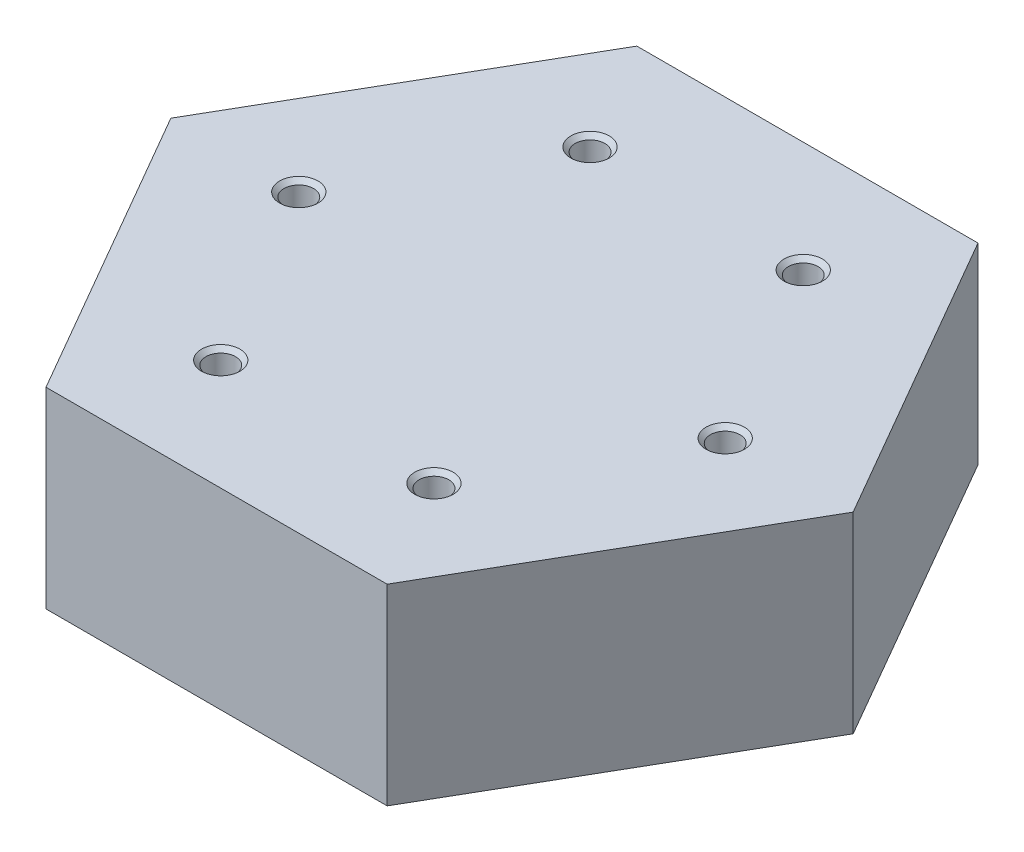
from build123d import *

# Parameters (mm, degrees)
BOSS_EXTRUDE1_DEPTH                         = 16.51
F_1_4_20_TAPPED_HOLE1_D                     = 5.1054
F_1_4_20_TAPPED_HOLE1_DEPTH                 = 19.05
F_1_4_20_TAPPED_HOLE1_CSINK_D               = 6.604
F_1_4_20_TAPPED_HOLE1_CSINK_ANGLE           = 90
F_1_4_20_TAPPED_HOLE1_TIP                   = 1.533816902
F_1_4_20_TAPPED_HOLE1_ON_FACE_2_D           = 5.1054
F_1_4_20_TAPPED_HOLE1_ON_FACE_2_DEPTH       = 19.05
F_1_4_20_TAPPED_HOLE1_ON_FACE_2_CSINK_D     = 6.604
F_1_4_20_TAPPED_HOLE1_ON_FACE_2_CSINK_ANGLE = 90
F_1_4_20_TAPPED_HOLE1_ON_FACE_2_TIP         = 1.533816902
F_1_4_20_TAPPED_HOLE1_ON_FACE_3_D           = 5.1054
F_1_4_20_TAPPED_HOLE1_ON_FACE_3_DEPTH       = 19.05
F_1_4_20_TAPPED_HOLE1_ON_FACE_3_CSINK_D     = 6.604
F_1_4_20_TAPPED_HOLE1_ON_FACE_3_CSINK_ANGLE = 90
F_1_4_20_TAPPED_HOLE1_ON_FACE_3_TIP         = 1.533816902


with BuildPart() as part:
    # Sketch1 → Boss-Extrude1 (new, symmetric)
    with BuildSketch(Plane(origin=(0, 0, 0), x_dir=(1, 0, 0), z_dir=(0, 1, 0))):
        Polygon((-58.65878735, 0), (-29.329393675, -50.8), (29.329393675, -50.8), (58.65878735, 0), (29.329393675, 50.8), (-29.329393675, 50.8), align=None)
    extrude(amount=BOSS_EXTRUDE1_DEPTH, both=True)

    # 1/4-20 Tapped Hole1
    with Locations(Plane(origin=(-43.994090512, 0, -25.4), x_dir=(0.5, 0, -0.866025403784), z_dir=(-0.866025403784, 0, -0.5))):
        with Locations((0, 0)):
            CounterSinkHole(F_1_4_20_TAPPED_HOLE1_D / 2, F_1_4_20_TAPPED_HOLE1_CSINK_D / 2, depth=F_1_4_20_TAPPED_HOLE1_DEPTH, counter_sink_angle=F_1_4_20_TAPPED_HOLE1_CSINK_ANGLE)
            with Locations((0, 0, -(F_1_4_20_TAPPED_HOLE1_DEPTH + F_1_4_20_TAPPED_HOLE1_TIP / 2))):  # 118° drill point
                Cone(0, F_1_4_20_TAPPED_HOLE1_D / 2, F_1_4_20_TAPPED_HOLE1_TIP, mode=Mode.SUBTRACT)

    # 1/4-20 Tapped Hole1 on face 2
    with Locations(Plane(origin=(-43.994090512, 0, 25.4), x_dir=(-0.500000174844, 0, -0.866025302838), z_dir=(-0.866025302838, 0, 0.500000174844))):
        with Locations((0, 0)):
            CounterSinkHole(F_1_4_20_TAPPED_HOLE1_ON_FACE_2_D / 2, F_1_4_20_TAPPED_HOLE1_ON_FACE_2_CSINK_D / 2, depth=F_1_4_20_TAPPED_HOLE1_ON_FACE_2_DEPTH, counter_sink_angle=F_1_4_20_TAPPED_HOLE1_ON_FACE_2_CSINK_ANGLE)
            with Locations((0, 0, -(F_1_4_20_TAPPED_HOLE1_ON_FACE_2_DEPTH + F_1_4_20_TAPPED_HOLE1_ON_FACE_2_TIP / 2))):  # 118° drill point
                Cone(0, F_1_4_20_TAPPED_HOLE1_ON_FACE_2_D / 2, F_1_4_20_TAPPED_HOLE1_ON_FACE_2_TIP, mode=Mode.SUBTRACT)

    # 1/4-20 Tapped Hole1 on face 3
    with Locations(Plane(origin=(18.330871047, 16.51, 31.75), x_dir=(0, 0, 1), z_dir=(0, 1, 0))):
        with Locations((0, 0), (-31.75, 18.330871047), (-63.5, -36.661742094), (-31.75, -54.992613141), (0, -36.661742094), (-63.5, 0)):
            CounterSinkHole(F_1_4_20_TAPPED_HOLE1_ON_FACE_3_D / 2, F_1_4_20_TAPPED_HOLE1_ON_FACE_3_CSINK_D / 2, depth=F_1_4_20_TAPPED_HOLE1_ON_FACE_3_DEPTH, counter_sink_angle=F_1_4_20_TAPPED_HOLE1_ON_FACE_3_CSINK_ANGLE)
            with Locations((0, 0, -(F_1_4_20_TAPPED_HOLE1_ON_FACE_3_DEPTH + F_1_4_20_TAPPED_HOLE1_ON_FACE_3_TIP / 2))):  # 118° drill point
                Cone(0, F_1_4_20_TAPPED_HOLE1_ON_FACE_3_D / 2, F_1_4_20_TAPPED_HOLE1_ON_FACE_3_TIP, mode=Mode.SUBTRACT)


solid = part.part
